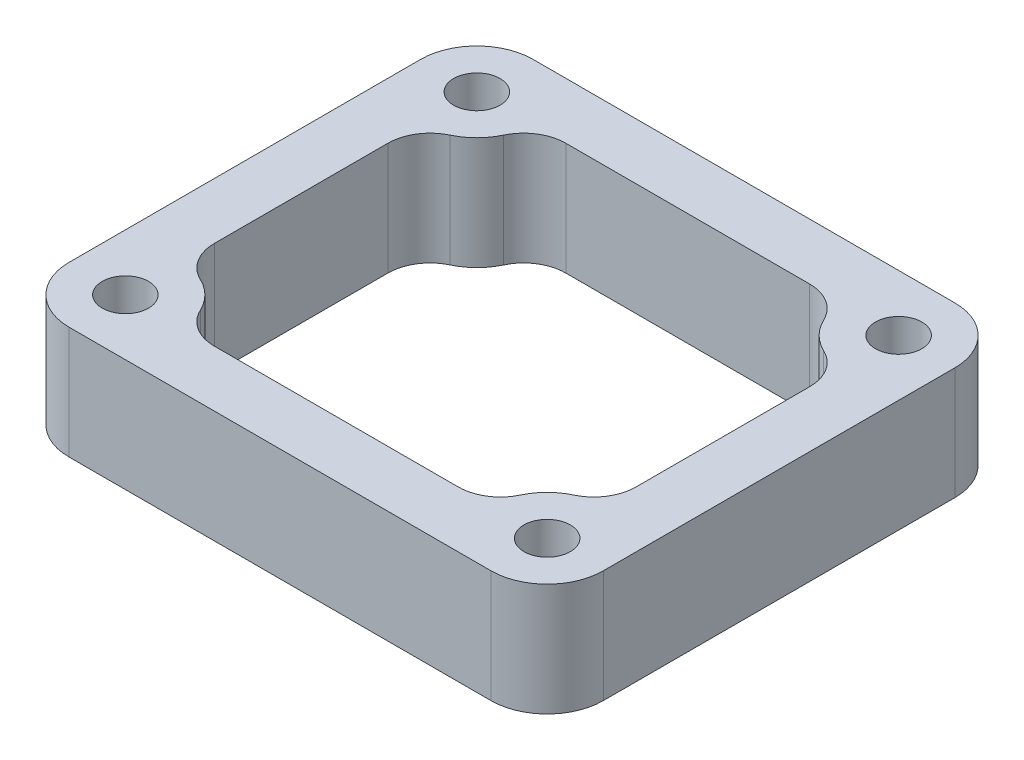
from build123d import *

# Parameters (mm, degrees)
SKETCH_1_R      = 1.65
EXTRUDE_1_DEPTH = 8
FILLET_1_R      = 3


with BuildPart() as part:
    # 草图1 → 凸台-拉伸1 (new body)
    with BuildSketch(Plane(origin=(0, 0, 0), x_dir=(1, 0, 0), z_dir=(0, 1, 0))):
        with BuildLine():
            Line((-19, 12.5), (-19, -12.5))
            ThreePointArc((-19, -12.5), (-17.828427125, -15.328427125), (-15, -16.5))
            Line((-15, -16.5), (15, -16.5))
            ThreePointArc((15, -16.5), (17.828427125, -15.328427125), (19, -12.5))
            Line((19, -12.5), (19, 12.5))
            ThreePointArc((19, 12.5), (17.828427125, 15.328427125), (15, 16.5))
            Line((15, 16.5), (-15, 16.5))
            ThreePointArc((-15, 16.5), (-17.828427125, 15.328427125), (-19, 12.5))
        make_face()
        with Locations(Location((-15, 12.5, 0), (0, 0, 270))):
            Circle(SKETCH_1_R, mode=Mode.SUBTRACT)
        with Locations(Location((15, 12.5, 0), (0, 0, 270))):
            Circle(SKETCH_1_R, mode=Mode.SUBTRACT)
        with Locations(Location((-15, -12.5, 0), (0, 0, 270))):
            Circle(SKETCH_1_R, mode=Mode.SUBTRACT)
        with Locations(Location((15, -12.5, 0), (0, 0, 270))):
            Circle(SKETCH_1_R, mode=Mode.SUBTRACT)
        with BuildLine():
            Line((-11, 12.5), (11, 12.5))
            ThreePointArc((11, 12.5), (12.171572875, 9.671572875), (15, 8.5))
            Line((15, 8.5), (15, -8.5))
            ThreePointArc((15, -8.5), (12.171572875, -9.671572875), (11, -12.5))
            Line((11, -12.5), (-11, -12.5))
            ThreePointArc((-11, -12.5), (-12.171572875, -9.671572875), (-15, -8.5))
            Line((-15, -8.5), (-15, 8.5))
            ThreePointArc((-15, 8.5), (-12.171572875, 9.671572875), (-11, 12.5))
        make_face(mode=Mode.SUBTRACT)
    extrude(amount=EXTRUDE_1_DEPTH)

    # 圆角1
    fillet_1_edges = [part.edges().sort_by_distance(p)[0] for p in [
        (-11, 4, -12.5),
        (-15, 4, -8.5),
        (-15, 4, 8.5),
        (-11, 4, 12.5),
        (11, 4, 12.5),
        (15, 4, 8.5),
        (15, 4, -8.5),
        (11, 4, -12.5),
    ]]
    fillet(fillet_1_edges, radius=FILLET_1_R)


solid = part.part
